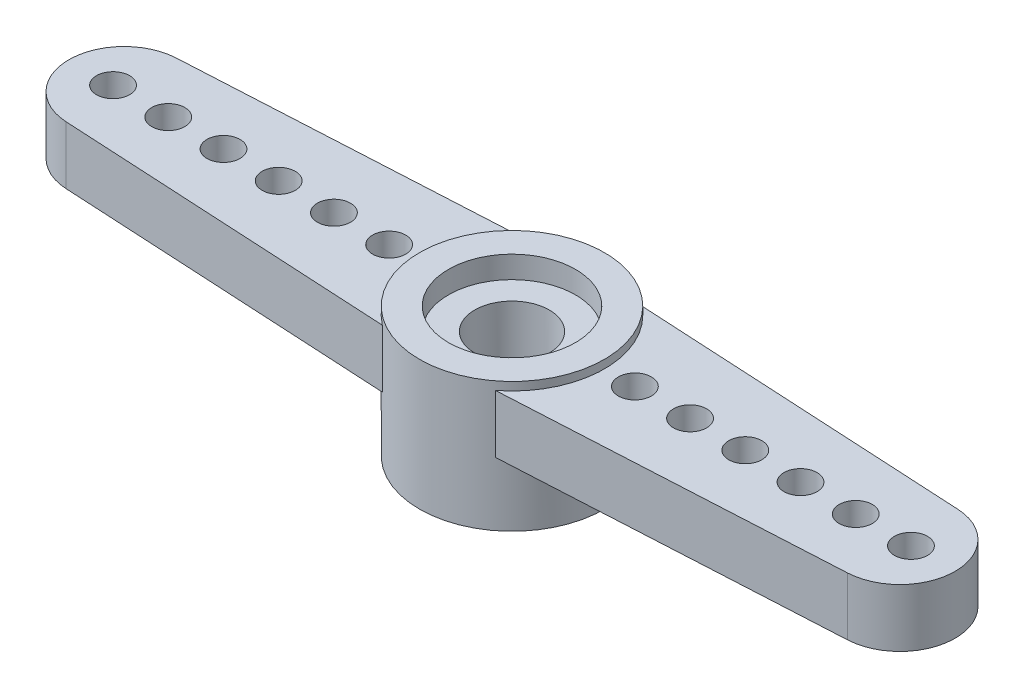
from build123d import *
from build123d.topology import SkipClean

# Parameters (mm, degrees)
RESSALTO_EXTRUS_O1_DEPTH = 2.1
ESBO_O2_R                = 3.35
RESSALTO_EXTRUS_O2_DEPTH = 2.3
FURO4_D                  = 1.2
PADR_O_LINEAR1_COUNT     = 6
PADR_O_LINEAR1_PITCH     = 2
PADR_OCIRCULAR2_COUNT    = 2
PADR_OCIRCULAR2_COPY_1_D = 1.2
PADR_OCIRCULAR2_COPY_2_D = 1.2
PADR_OCIRCULAR2_COPY_3_D = 1.2
PADR_OCIRCULAR2_COPY_4_D = 1.2
PADR_OCIRCULAR2_COPY_5_D = 1.2
FURO1_D                  = 4.95
FURO1_DEPTH              = 2
FURO2_D                  = 4.6
FURO2_DEPTH              = 0.5
FURO3_D                  = 2.7
RESSALTO_EXTRUS_O3_START = -2
RESSALTO_EXTRUS_O3_DEPTH = 2
PADR_OCIRCULAR1_COUNT    = 60
SKETCH1_R                = 3.35
SKETCH1_R_2              = 2.3
BOSS_EXTRUDE1_DEPTH      = 0.3


with BuildPart() as part:
    # Esboço1 → Ressalto-extrusão1 (new body)
    with BuildSketch(Plane(origin=(0, 0, 0), x_dir=(1, 0, 0), z_dir=(0, 1, 0))):
        with BuildLine():
            Line((-14.157687171, 1.997098764), (-2.049390153, 2.65))
            ThreePointArc((-2.049390153, 2.65), (3.35, 0), (-2.049390153, -2.65))
            Line((-2.049390153, -2.65), (-14.157687171, -1.997098764))
            ThreePointArc((-14.157687171, -1.997098764), (-16.05, 0), (-14.157687171, 1.997098764))
        make_face()
    ressalto_extrus_o1 = extrude(amount=-RESSALTO_EXTRUS_O1_DEPTH)

    # Esboço2 → Ressalto-extrusão2 (add)
    with BuildSketch(Plane.XZ.offset(2.1)):
        with Locations(Location((0, 0, 0), (0, 0, 90))):
            Circle(ESBO_O2_R)
    extrude(amount=RESSALTO_EXTRUS_O2_DEPTH)

    # Furo4 (through all)
    with Locations(Plane(origin=(0, 0, 0), x_dir=(1, 0, 0), z_dir=(0, 1, 0))):
        with Locations((-14.45, 0)):
            furo4 = Hole(FURO4_D / 2)

    # Padrão linear1: Furo4 ×6
    with Locations(*[(i * PADR_O_LINEAR1_PITCH, 0, 0) for i in range(1, PADR_O_LINEAR1_COUNT)]):
        add(furo4, mode=Mode.SUBTRACT)

    # PadrãoCircular2: Ressalto-extrusão1, Furo4 ×2 about axis
    padr_ocircular2_axis = Axis((0, 0, 0), (0, 1, 0))
    add([ressalto_extrus_o1.rotate(padr_ocircular2_axis, i * 360 / PADR_OCIRCULAR2_COUNT) for i in range(1, PADR_OCIRCULAR2_COUNT)])
    add([furo4.rotate(padr_ocircular2_axis, i * 360 / PADR_OCIRCULAR2_COUNT) for i in range(1, PADR_OCIRCULAR2_COUNT)], mode=Mode.SUBTRACT)

    # PadrãoCircular2 copy 1 (through all)
    with Locations(Plane(origin=(-2, 0, 0), x_dir=(-1, 0, 0), z_dir=(0, 1, 0))):
        with Locations((-14.45, 0)):
            Hole(PADR_OCIRCULAR2_COPY_1_D / 2)

    # PadrãoCircular2 copy 2 (through all)
    with Locations(Plane(origin=(-4, 0, 0), x_dir=(-1, 0, 0), z_dir=(0, 1, 0))):
        with Locations((-14.45, 0)):
            Hole(PADR_OCIRCULAR2_COPY_2_D / 2)

    # PadrãoCircular2 copy 3 (through all)
    with Locations(Plane(origin=(-6, 0, 0), x_dir=(-1, 0, 0), z_dir=(0, 1, 0))):
        with Locations((-14.45, 0)):
            Hole(PADR_OCIRCULAR2_COPY_3_D / 2)

    # PadrãoCircular2 copy 4 (through all)
    with Locations(Plane(origin=(-8, 0, 0), x_dir=(-1, 0, 0), z_dir=(0, 1, 0))):
        with Locations((-14.45, 0)):
            Hole(PADR_OCIRCULAR2_COPY_4_D / 2)

    # PadrãoCircular2 copy 5 (through all)
    with Locations(Plane(origin=(-10, 0, 0), x_dir=(-1, 0, 0), z_dir=(0, 1, 0))):
        with Locations((-14.45, 0)):
            Hole(PADR_OCIRCULAR2_COPY_5_D / 2)

    # Furo1
    with Locations(Plane(origin=(0, -4.4, 0), x_dir=(-1, 0, 0), z_dir=(0, -1, 0))):
        with Locations((0, 0)):
            Hole(FURO1_D / 2, depth=FURO1_DEPTH)

    # Furo2
    with Locations(Plane(origin=(0, 0, 0), x_dir=(1, 0, 0), z_dir=(0, 1, 0))):
        with Locations((0, 0)):
            Hole(FURO2_D / 2, depth=FURO2_DEPTH)

    # Furo3 (through all)
    with Locations(Plane(origin=(0, 0, 0), x_dir=(1, 0, 0), z_dir=(0, 1, 0))):
        with Locations((0, 0)):
            Hole(FURO3_D / 2)

    # Esboço11 → Ressalto-extrusão3 (add)
    with BuildSketch(Plane.XZ.offset(4.4).offset(RESSALTO_EXTRUS_O3_START)):
        with BuildLine():
            Line((-0.098056786, 2.473056786), (0, 2.375))
            Line((0, 2.375), (0.098056786, 2.473056786))
            ThreePointArc((0.098056786, 2.473056786), (0, 2.475), (-0.098056786, 2.473056786))
        make_face()
    ressalto_extrus_o3 = extrude(amount=RESSALTO_EXTRUS_O3_DEPTH)

    # PadrãoCircular1: Ressalto-extrusão3 ×60 about axis
    padr_ocircular1_axis = Axis((0, 0, 0), (0, 1, 0))
    for i in range(1, PADR_OCIRCULAR1_COUNT):
        add(ressalto_extrus_o3.rotate(padr_ocircular1_axis, i * 360 / PADR_OCIRCULAR1_COUNT))

    # Sketch1 → Boss-Extrude1 (add)
    with SkipClean():  # the faces are left unmerged after this step: merging them gives an invalid solid
        with BuildSketch(Plane(origin=(0, 0, 0), x_dir=(1, 0, 0), z_dir=(0, 1, 0))):
            with Locations(Location((0, 0, 0), (0, 0, 270))):
                Circle(SKETCH1_R)
            with Locations(Location((0, 0, 0), (0, 0, 270))):
                Circle(SKETCH1_R_2, mode=Mode.SUBTRACT)
        extrude(amount=BOSS_EXTRUDE1_DEPTH)


solid = part.part
